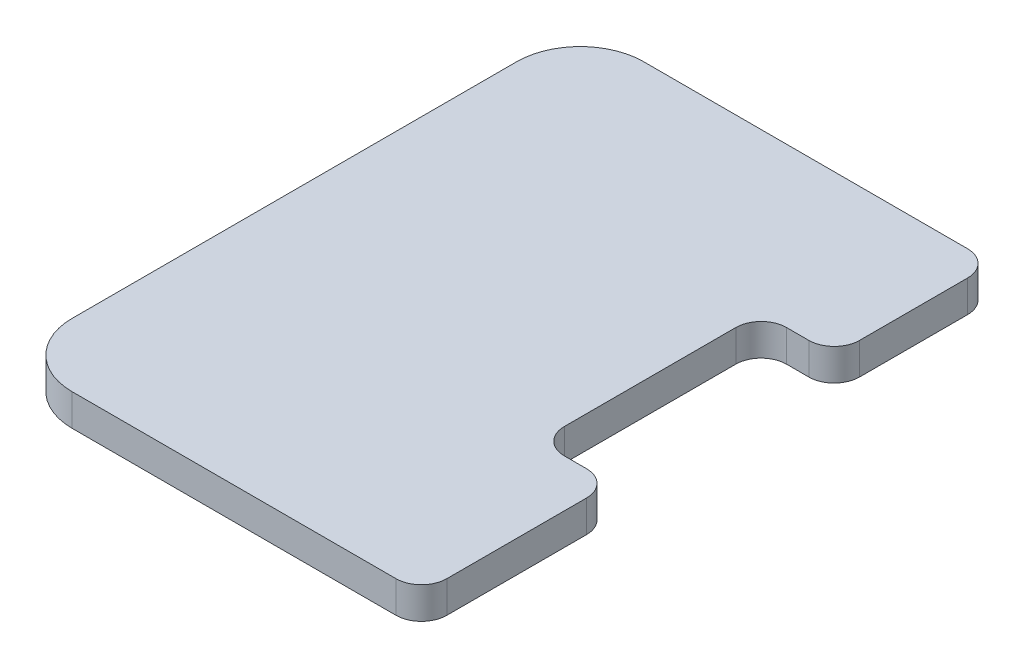
from build123d import *

# Parameters (mm, degrees)
SKETCH1_W           = 41.275
SKETCH1_H           = 57.15
BOSS_EXTRUDE1_DEPTH = 3.175
SKETCH2_W           = 7.3025
SKETCH2_H           = 22.225
CUT_EXTRUDE2_DEPTH  = 36.390926185
FILLET1_R           = 2.54
FILLET2_R           = 6.35


with BuildPart() as part:
    # Sketch1 → Boss-Extrude1 (new body)
    with BuildSketch(Plane(origin=(0, 0, 0), x_dir=(1, 0, 0), z_dir=(0, 1, 0))):
        Rectangle(SKETCH1_W, SKETCH1_H)
    extrude(amount=BOSS_EXTRUDE1_DEPTH)

    # Sketch2 → Cut-Extrude2 (cut, through all)
    with BuildSketch(Plane(origin=(0, 3.175, 0), x_dir=(1, 0, 0), z_dir=(0, 1, 0))):
        with Locations((16.98625, 1.5875)):
            Rectangle(SKETCH2_W, SKETCH2_H)
    extrude(amount=-CUT_EXTRUDE2_DEPTH, mode=Mode.SUBTRACT)

    # Fillet1
    fillet1_edges = [part.edges().sort_by_distance(p)[0] for p in [
        (20.6375, 1.5875, -12.7),
        (20.6375, 1.5875, 9.525),
        (13.335, 1.5875, 9.525),
        (13.335, 1.5875, -12.7),
        (20.6375, 1.5875, 28.575),
        (20.6375, 1.5875, -28.575),
    ]]
    fillet(fillet1_edges, radius=FILLET1_R)

    # Fillet2
    fillet2_edges = [part.edges().sort_by_distance(p)[0] for p in [
        (-20.6375, 1.5875, 28.575),
        (-20.6375, 1.5875, -28.575),
    ]]
    fillet(fillet2_edges, radius=FILLET2_R)


solid = part.part
